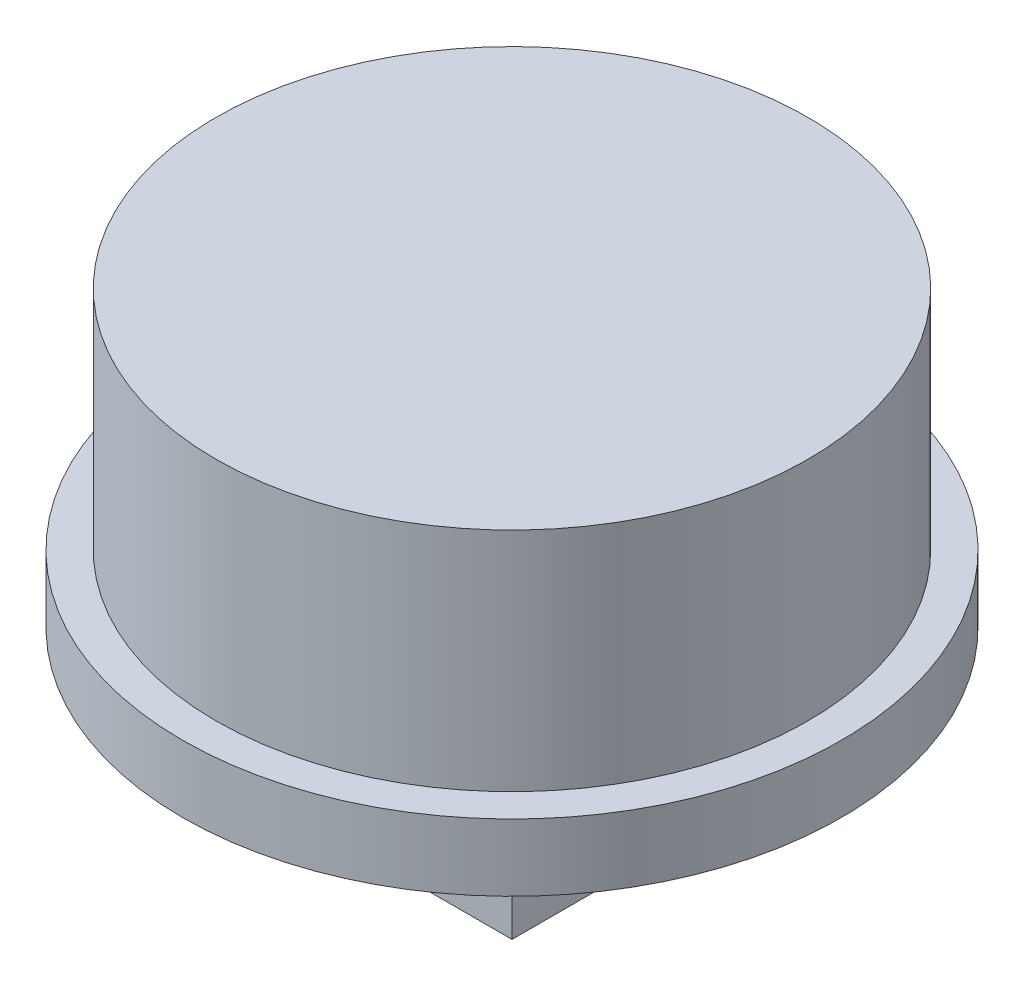
from build123d import *

# Parameters (mm, degrees)
SKETCH1_R           = 6.4
BOSS_EXTRUDE1_DEPTH = 1.3
SKETCH1_3_R         = 5.75
BOSS_EXTRUDE2_DEPTH = 5.7
SKETCH2_W           = 5.5
SKETCH2_H           = 5.5
SKETCH2_W_2         = 3.8
SKETCH2_H_2         = 3.8
BOSS_EXTRUDE3_DEPTH = 2.5


with BuildPart() as part:
    # Sketch1 → Boss-Extrude1 (new body)
    with BuildSketch(Plane(origin=(0, 0, 0), x_dir=(1, 0, 0), z_dir=(0, 1, 0))):
        Circle(SKETCH1_R)
    extrude(amount=BOSS_EXTRUDE1_DEPTH)

    # Sketch1<3> → Boss-Extrude2 (add)
    with BuildSketch(Plane(origin=(0, 0, 0), x_dir=(1, 0, 0), z_dir=(0, 1, 0))):
        Circle(SKETCH1_3_R)
    extrude(amount=BOSS_EXTRUDE2_DEPTH)

    # Sketch2 → Boss-Extrude3 (add)
    with BuildSketch(Plane(origin=(0, 0, 0), x_dir=(1, 0, 0), z_dir=(0, 1, 0))):
        Rectangle(SKETCH2_W, SKETCH2_H)
        Rectangle(SKETCH2_W_2, SKETCH2_H_2, mode=Mode.SUBTRACT)
    extrude(amount=-BOSS_EXTRUDE3_DEPTH)


solid = part.part
